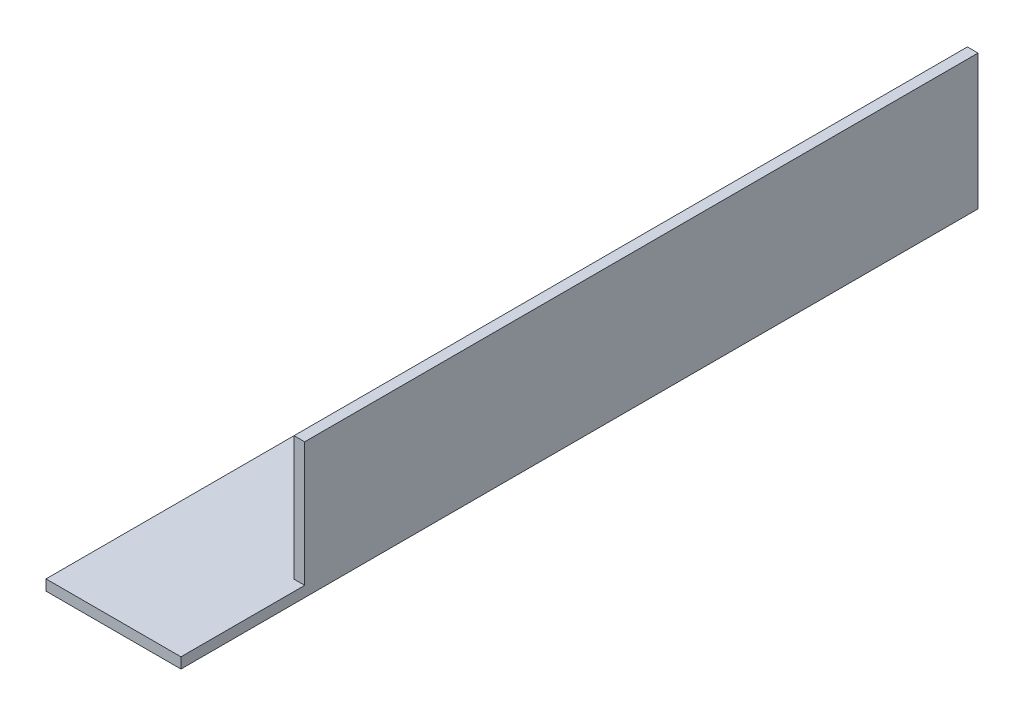
from build123d import *

# Parameters (mm, degrees)
EXTRUDE_THIN1_DEPTH = 150
SKETCH2_W           = 45.118710081
SKETCH2_H           = 31.585408516
CUT_EXTRUDE1_DEPTH  = 29


with BuildPart() as part:
    # Sketch1 → Extrude-Thin1 (new body)
    with BuildSketch(Plane.XY):
        Polygon((0, 25.4), (0, 0), (-25.4, 0), (-25.4, 2), (-2, 2), (-2, 25.4), align=None)
    extrude(amount=EXTRUDE_THIN1_DEPTH)

    # Sketch2 → Cut-Extrude1 (cut)
    with BuildSketch(Plane(origin=(0, 0, 0), x_dir=(0, 0, -1), z_dir=(1, 0, 0))):
        with Locations((-149.273891859, 17.792704258)):
            Rectangle(SKETCH2_W, SKETCH2_H)
    extrude(amount=-CUT_EXTRUDE1_DEPTH, mode=Mode.SUBTRACT)


solid = part.part
